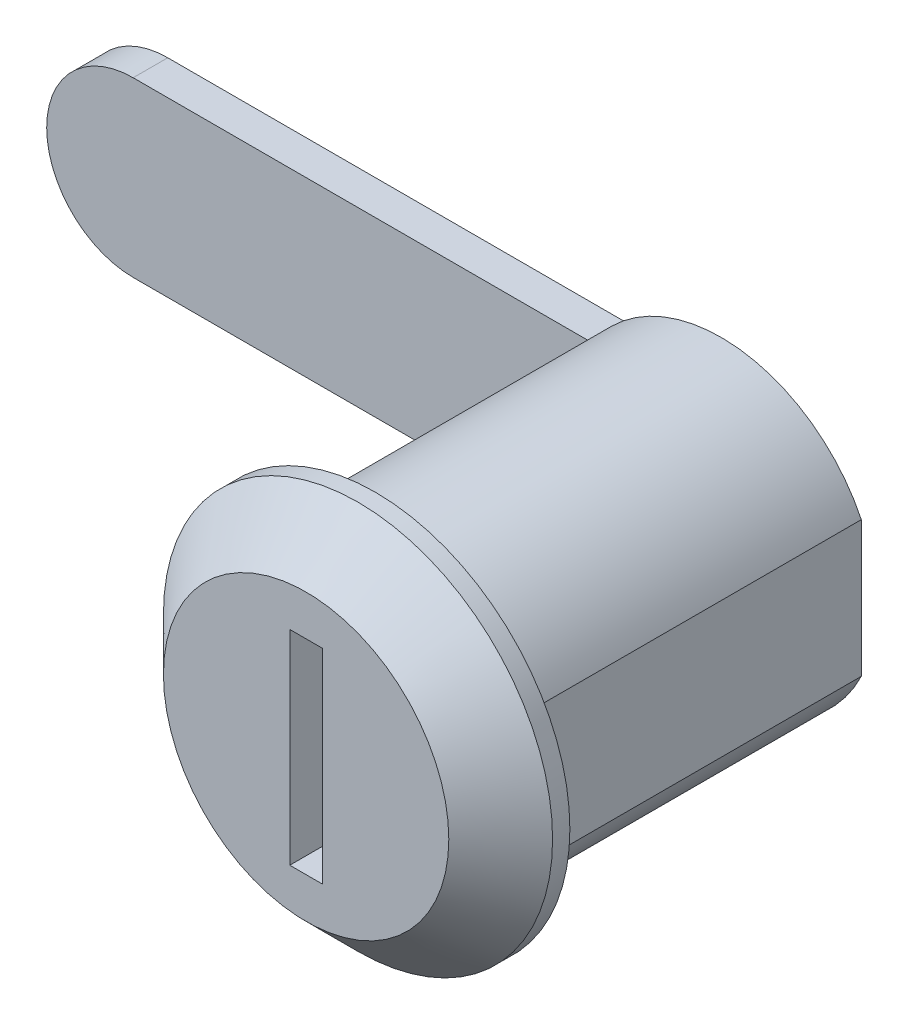
from build123d import *

# Parameters (mm, degrees)
SKETCH_1_R          = 11.25
EXTRUDE_1_DEPTH     = 4
SKETCH_2_W          = 1.89000918
SKETCH_2_H          = 11.806467468
CUT_EXTRUDE_1_DEPTH = 2
EXTRUDE_2_DEPTH     = 20
EXTRUDE_3_DEPTH     = 2
CHAMFER_1_SIZE      = 3


with BuildPart() as part:
    # 草图1 → 凸台-拉伸1 (new body)
    with BuildSketch(Plane.XY):
        Circle(SKETCH_1_R)
    extrude(amount=EXTRUDE_1_DEPTH)

    # 草图2 → 切除-拉伸1 (cut)
    with BuildSketch(Plane.XY.offset(4)):
        Rectangle(SKETCH_2_W, SKETCH_2_H)
    extrude(amount=-CUT_EXTRUDE_1_DEPTH, mode=Mode.SUBTRACT)

    # 草图3 → 凸台-拉伸2 (add)
    with BuildSketch(Plane(origin=(0, 0, 0), x_dir=(-1, 0, 0), z_dir=(0, 0, -1))):
        with BuildLine():
            Line((-8.1, -3.923009049), (-8.1, 3.923009049))
            ThreePointArc((-8.1, 3.923009049), (0, 9), (8.1, 3.923009049))
            Line((8.1, 3.923009049), (8.1, -3.923009049))
            ThreePointArc((8.1, -3.923009049), (0, -9), (-8.1, -3.923009049))
        make_face()
    extrude(amount=EXTRUDE_2_DEPTH)

    # 草图4 → 凸台-拉伸3 (add)
    with BuildSketch(Plane(origin=(0, 0, -20), x_dir=(-1, 0, 0), z_dir=(0, 0, -1))):
        with BuildLine():
            Line((0, 5), (34, 5))
            ThreePointArc((34, 5), (39, 0), (34, -5))
            Line((34, -5), (0, -5))
            ThreePointArc((0, -5), (-5, 0), (0, 5))
        make_face()
    extrude(amount=EXTRUDE_3_DEPTH)

    # 倒角1
    chamfer_1_edges = [part.edges().sort_by_distance(p)[0] for p in [
        (-11.25, 0, 4),
    ]]
    chamfer(chamfer_1_edges, length=CHAMFER_1_SIZE)


solid = part.part
